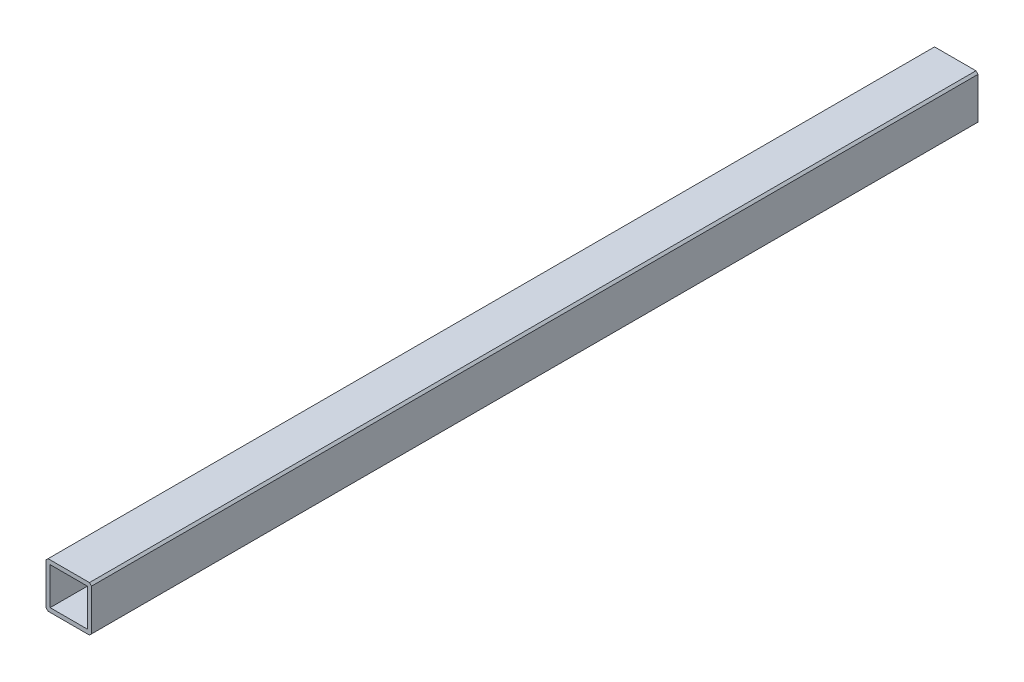
from build123d import *

# Parameters (mm, degrees)
SCHIZZO1_W          = 11
SCHIZZO1_H          = 11
SCHIZZO1_W_2        = 9
SCHIZZO1_H_2        = 9
EXTRUDE_THIN1_DEPTH = 214.16
CHAMFER1_SIZE       = 0.5


with BuildPart() as part:
    # Schizzo1 → Extrude-Thin1 (new body)
    with BuildSketch(Plane.XY):
        with Locations((5.5, 5.5)):
            Rectangle(SCHIZZO1_W, SCHIZZO1_H)
        with Locations((5.5, 5.5)):
            Rectangle(SCHIZZO1_W_2, SCHIZZO1_H_2, mode=Mode.SUBTRACT)
    extrude(amount=EXTRUDE_THIN1_DEPTH)

    # Chamfer1
    chamfer1_edges = [part.edges().sort_by_distance(p)[0] for p in [
        (11, 11, 107.08),
        (0, 11, 107.08),
        (0, 0, 107.08),
        (11, 0, 107.08),
    ]]
    chamfer(chamfer1_edges, length=CHAMFER1_SIZE)


solid = part.part
